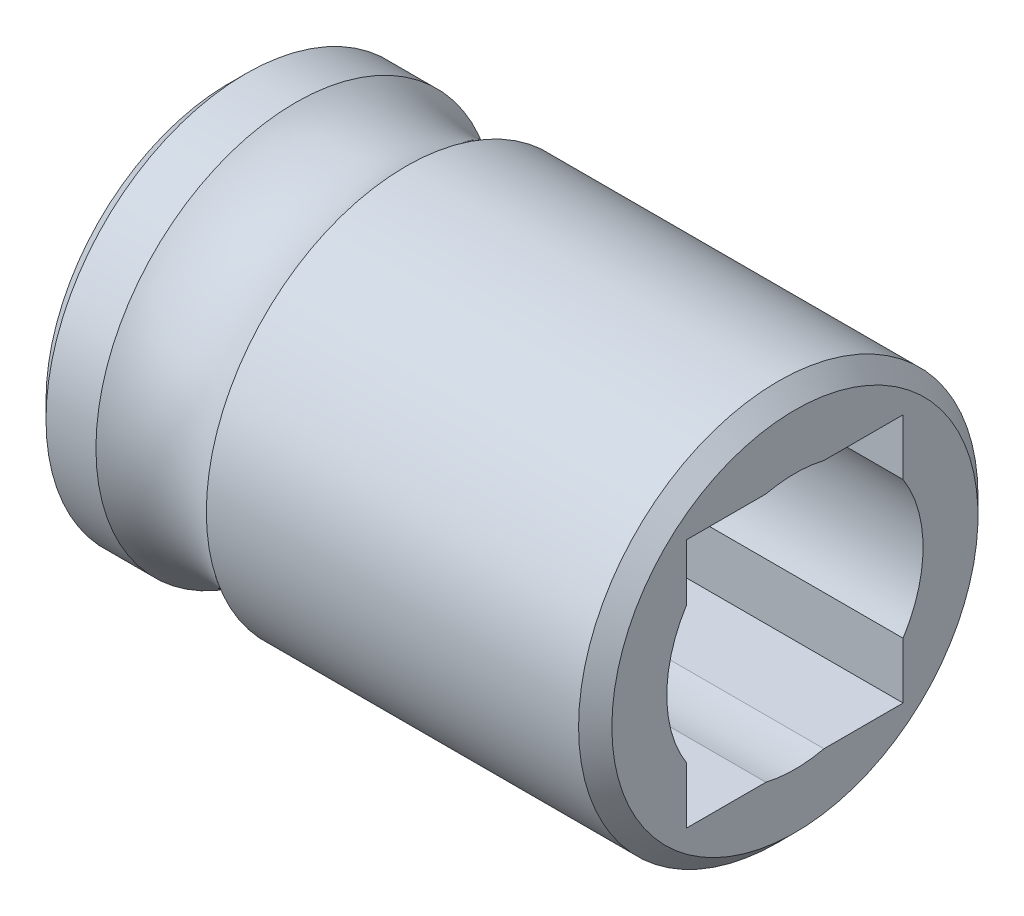
from build123d import *

# Parameters (mm, degrees)
ESQUISSE2_W             = 6.5
ESQUISSE2_H             = 7.5
ENL_V_MAT_EXTRU_1_DEPTH = 20


with BuildPart() as part:
    # Esquisse1 → Révolution1 (revolve)
    with BuildSketch(Plane.XY):
        with BuildLine():
            Line((-17, 5.5), (-17, 3.85))
            Line((-17, 3.85), (0, 3.85))
            Line((0, 3.85), (0, 5.5))
            Line((0, 5.5), (-0.5, 6))
            Line((-0.5, 6), (-11.68337521, 6))
            ThreePointArc((-11.68337521, 6), (-13.341687605, 5.5), (-15, 6))
            Line((-15, 6), (-16.5, 6))
            Line((-16.5, 6), (-17, 5.5))
        make_face()
    revolve(axis=Axis((-34.750549451, 0, 0), (1, 0, 0)))

    # Esquisse2 → Enlèv. mat.-Extru.1 (cut, through all)
    with BuildSketch(Plane(origin=(0, 0, 0), x_dir=(0, 0, -1), z_dir=(1, 0, 0))):
        Rectangle(ESQUISSE2_W, ESQUISSE2_H)
    extrude(amount=-ENL_V_MAT_EXTRU_1_DEPTH, mode=Mode.SUBTRACT)


solid = part.part
